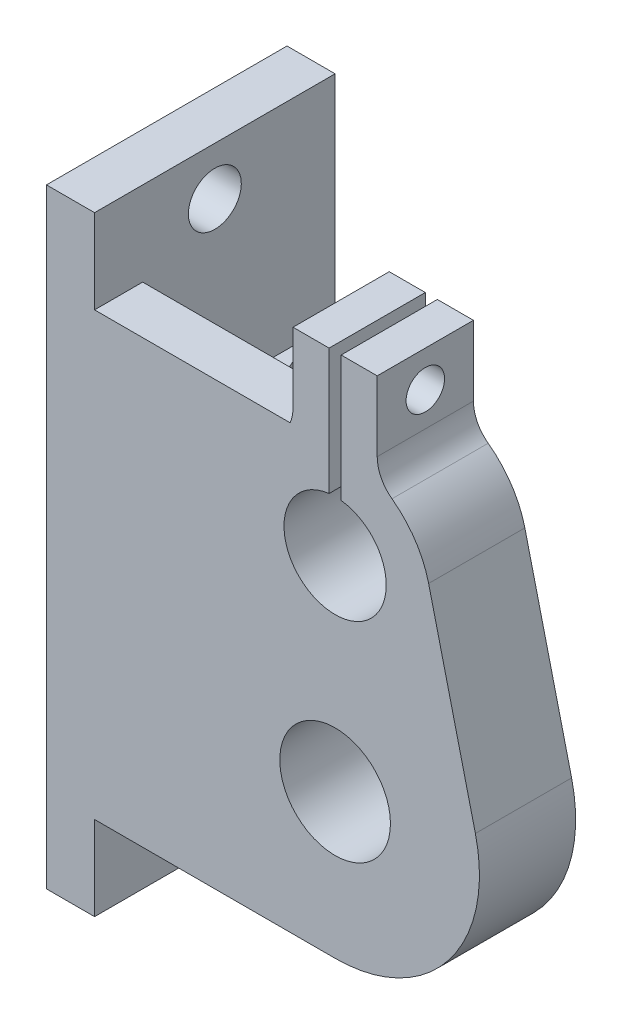
from build123d import *

# Parameters (mm, degrees)
SKETCH_1_R          = 4.6
EXTRUDE_1_DEPTH     = 4
EXTRUDE_START       = -4
SKETCH_1_4_R        = 4.6
SKETCH_1_4_W        = 4
SKETCH_1_4_H        = 50.693747285
EXTRUDE_2_DEPTH     = 4
EXTRUDE_3_DEPTH     = 12
SKETCH_4_R          = 2.2
CUT_EXTRUDE_2_DEPTH = 12
SKETCH_4_3_R        = 1.6
CUT_EXTRUDE_3_DEPTH = 64.691687079
RIB_6_REACH         = 53.839
SKETCH_6_WALL_W     = 120.90928936
SKETCH_6_WALL_H     = 5
RIB_7_REACH         = 51.729
SKETCH_8_WALL_W     = 116.68872775
SKETCH_8_WALL_H     = 5


with BuildPart() as part:
    # 草图1 → 凸台-拉伸1 (new body)
    with BuildSketch(Plane.XY):
        with BuildLine():
            ThreePointArc((20.5, 46.874119675), (20.438884601, 46.271660298), (20.258028466, 45.693747285))
            Line((20.258028466, 45.693747285), (4, 45.693747285))
            Line((4, 45.693747285), (4, 52.693747285))
            Line((4, 52.693747285), (0, 52.693747285))
            Line((0, 52.693747285), (0, 2))
            Line((0, 2), (4, 2))
            Line((4, 2), (4, 9))
            Line((4, 9), (23.999999933, 9))
            ThreePointArc((23.999999933, 9), (33.430862955, 13.579836665), (35.663090571, 23.823529412))
            Line((35.663090571, 23.823529412), (31.775393714, 39.882352941))
            ThreePointArc((31.775393714, 39.882352941), (30.656120461, 42.438024382), (28.727272727, 44.453905218))
            ThreePointArc((28.727272727, 44.453905218), (28.15133251, 45.007636077), (27.741971534, 45.693747285))
            ThreePointArc((27.741971534, 45.693747285), (27.561115399, 46.271660298), (27.5, 46.874119675))
            Line((27.5, 46.874119675), (27.5, 52.693747285))
            Line((27.5, 52.693747285), (24.5, 52.693747285))
            Line((24.5, 52.693747285), (24.5, 42.220485754))
            ThreePointArc((24.5, 42.220485754), (24, 33.75), (23.5, 42.220485754))
            Line((23.5, 42.220485754), (23.5, 52.693747285))
            Line((23.5, 52.693747285), (20.5, 52.693747285))
            Line((20.5, 52.693747285), (20.5, 46.874119675))
        make_face()
        with Locations((24, 21)):
            Circle(SKETCH_1_R, mode=Mode.SUBTRACT)
    extrude(amount=EXTRUDE_1_DEPTH)

    # 草图1<4> → 凸台-拉伸2 (add)
    # profile 1 of 2: a face of its own
    with BuildSketch(Plane.XY.offset(EXTRUDE_START)):
        with BuildLine():
            ThreePointArc((19.272727273, 44.453905218), (17.343879539, 42.438024382), (16.224606286, 39.882352941))
            Line((16.224606286, 39.882352941), (12.336909429, 23.823529412))
            ThreePointArc((12.336909429, 23.823529412), (24, 9), (35.663090571, 23.823529412))
            Line((35.663090571, 23.823529412), (31.775393714, 39.882352941))
            ThreePointArc((31.775393714, 39.882352941), (30.656120461, 42.438024382), (28.727272727, 44.453905218))
            ThreePointArc((28.727272727, 44.453905218), (28.15133251, 45.007636077), (27.741971534, 45.693747285))
            ThreePointArc((27.741971534, 45.693747285), (27.561115399, 46.271660298), (27.5, 46.874119675))
            Line((27.5, 46.874119675), (27.5, 52.693747285))
            Line((27.5, 52.693747285), (24.5, 52.693747285))
            Line((24.5, 52.693747285), (24.5, 42.220485754))
            ThreePointArc((24.5, 42.220485754), (24, 33.75), (23.5, 42.220485754))
            Line((23.5, 42.220485754), (23.5, 52.693747285))
            Line((23.5, 52.693747285), (20.5, 52.693747285))
            Line((20.5, 52.693747285), (20.5, 46.874119675))
            ThreePointArc((20.5, 46.874119675), (20.438884601, 46.271660298), (20.258028466, 45.693747285))
            ThreePointArc((20.258028466, 45.693747285), (19.84866749, 45.007636077), (19.272727273, 44.453905218))
        make_face()
        with Locations((24, 21)):
            Circle(SKETCH_1_4_R, mode=Mode.SUBTRACT)
    # profile 2 of 2: a face of its own
    with BuildSketch(Plane.XY.offset(EXTRUDE_START)):
        with Locations((2, 27.346873643)):
            Rectangle(SKETCH_1_4_W, SKETCH_1_4_H)
    extrude(amount=EXTRUDE_2_DEPTH)

    # 草图1<5> → 凸台-拉伸3 (add)
    with BuildSketch(Plane.XY.offset(EXTRUDE_START)):
        Polygon((4, 45.693747285), (4, 9), (4, 2), (0, 2), (0, 52.693747285), (4, 52.693747285), align=None)
    extrude(amount=-EXTRUDE_3_DEPTH)

    # 草图4 → 切除-拉伸2 (cut)
    with BuildSketch(Plane(origin=(4, 0, 0), x_dir=(0, 0, -1), z_dir=(1, 0, 0))):
        with Locations(Location((6, 48.693747285, 0), (0, 0, 90))):
            Circle(SKETCH_4_R)
        with Locations(Location((6, 6, 0), (0, 0, 90))):
            Circle(SKETCH_4_R)
    extrude(amount=-CUT_EXTRUDE_2_DEPTH, mode=Mode.SUBTRACT)

    # 草图4<3> → 切除-拉伸3 (cut, through all)
    with BuildSketch(Plane(origin=(4, 0, 0), x_dir=(0, 0, -1), z_dir=(1, 0, 0))):
        with Locations((0, 49.693747285)):
            Circle(SKETCH_4_3_R)
    extrude(amount=CUT_EXTRUDE_3_DEPTH, mode=Mode.SUBTRACT)

    # 草图6 wall → 筋6 (add, up to next)
    with BuildSketch(Plane(origin=(7, 19, -7), x_dir=(0.393919298579, 0, 0.919145030018), z_dir=(-0.919145030018, 0, 0.393919298579)), mode=Mode.PRIVATE) as rib_6_sk1:
        Rectangle(SKETCH_6_WALL_W, SKETCH_6_WALL_H)
    rib_6_tool1 = extrude(rib_6_sk1.sketch, amount=RIB_6_REACH, mode=Mode.PRIVATE) - part.part
    add(rib_6_tool1.solids().sort_by_distance((7, 19, -7))[0])

    # 草图8 wall → 筋7 (add, up to next)
    with BuildSketch(Plane(origin=(7, 32.346873642, -7), x_dir=(0.393919298579, 0, 0.919145030018), z_dir=(-0.919145030018, 0, 0.393919298579)), mode=Mode.PRIVATE) as rib_7_sk1:
        Rectangle(SKETCH_8_WALL_W, SKETCH_8_WALL_H)
    rib_7_tool1 = extrude(rib_7_sk1.sketch, amount=RIB_7_REACH, mode=Mode.PRIVATE) - part.part
    add(rib_7_tool1.solids().sort_by_distance((7, 32.346873642, -7))[0])


solid = part.part
